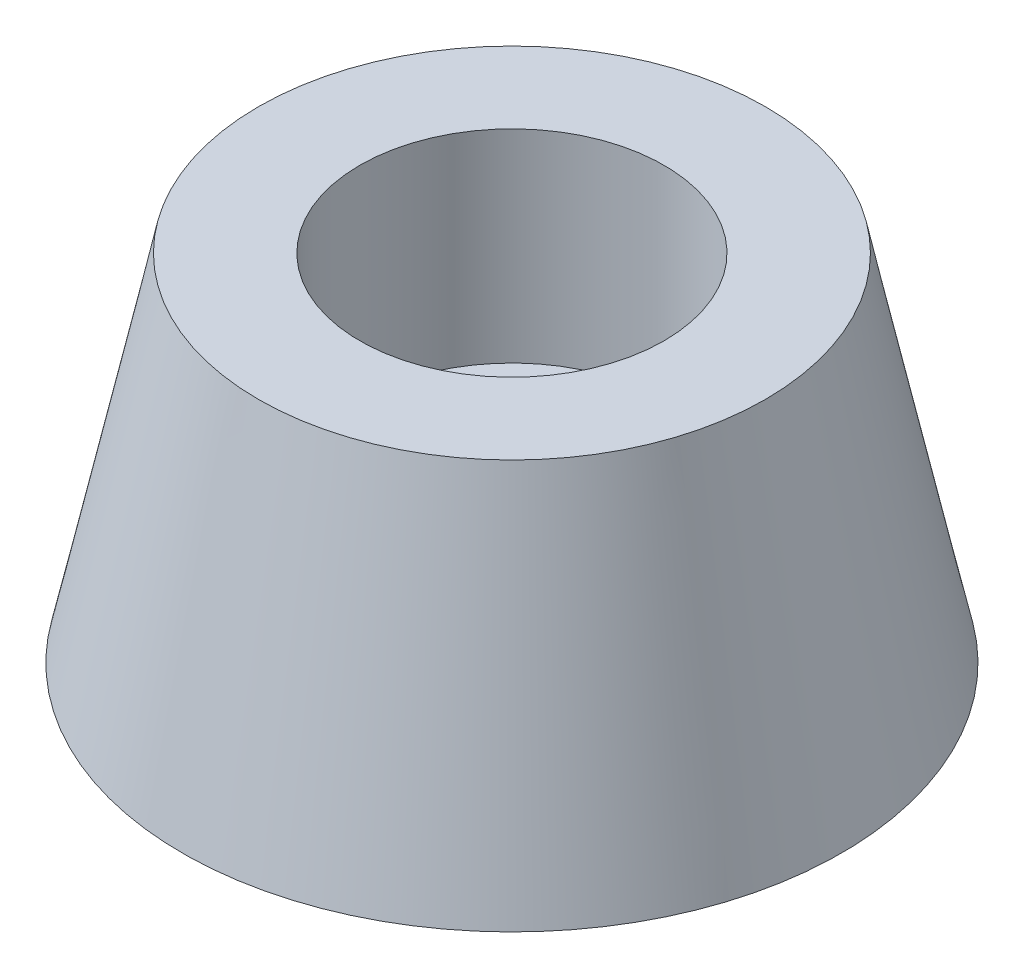
from build123d import *

# Parameters (mm, degrees)
SKETCH2_R          = 1.65
CUT_EXTRUDE1_DEPTH = 10
SKETCH3_R          = 3
CUT_EXTRUDE2_DEPTH = 4


with BuildPart() as part:
    # Sketch1 → Revolve1 (revolve)
    with BuildSketch(Plane.XY, mode=Mode.PRIVATE) as revolve1_sk:
        Polygon((0, -7), (6.5, -7), (5, 0), (0, 0), align=None)
    revolve(revolve1_sk.sketch.rotate(Axis((0, 0, 0), (0, -1, 0)), 180), axis=Axis((0, 0, 0), (0, -1, 0)))

    # Sketch2 → Cut-Extrude1 (cut)
    with BuildSketch(Plane(origin=(0, 0, 0), x_dir=(1, 0, 0), z_dir=(0, 1, 0))):
        with Locations(Location((0, 0, 0), (0, 0, 180))):
            Circle(SKETCH2_R)
    extrude(amount=-CUT_EXTRUDE1_DEPTH, mode=Mode.SUBTRACT)

    # Sketch3 → Cut-Extrude2 (cut)
    with BuildSketch(Plane(origin=(0, 0, 0), x_dir=(1, 0, 0), z_dir=(0, 1, 0))):
        with Locations(Location((0, 0, 0), (0, 0, 180))):
            Circle(SKETCH3_R)
    extrude(amount=-CUT_EXTRUDE2_DEPTH, mode=Mode.SUBTRACT)


solid = part.part
